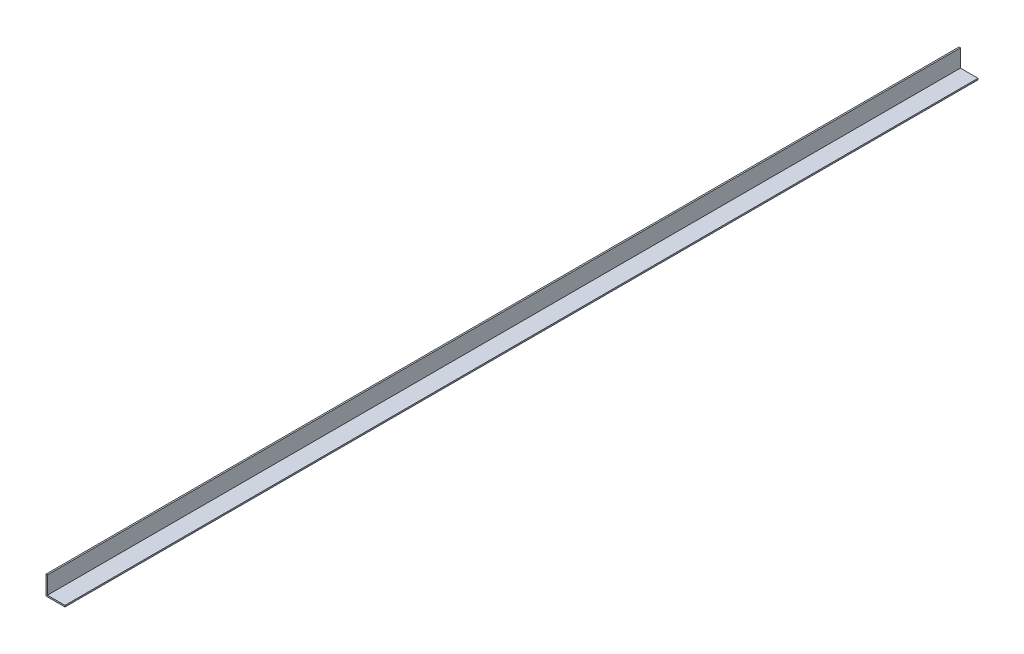
from build123d import *

# Parameters (mm, degrees)
SALIENTE_EXTRUIR1_DEPTH = 6100


with BuildPart() as part:
    # Croquis1 → Saliente-Extruir1 (new body)
    with BuildSketch(Plane.XY):
        Polygon((0, 127), (0, 0), (127, 0), (127, 9.53), (9.53, 9.53), (9.53, 127), align=None)
    extrude(amount=-SALIENTE_EXTRUIR1_DEPTH)


solid = part.part
